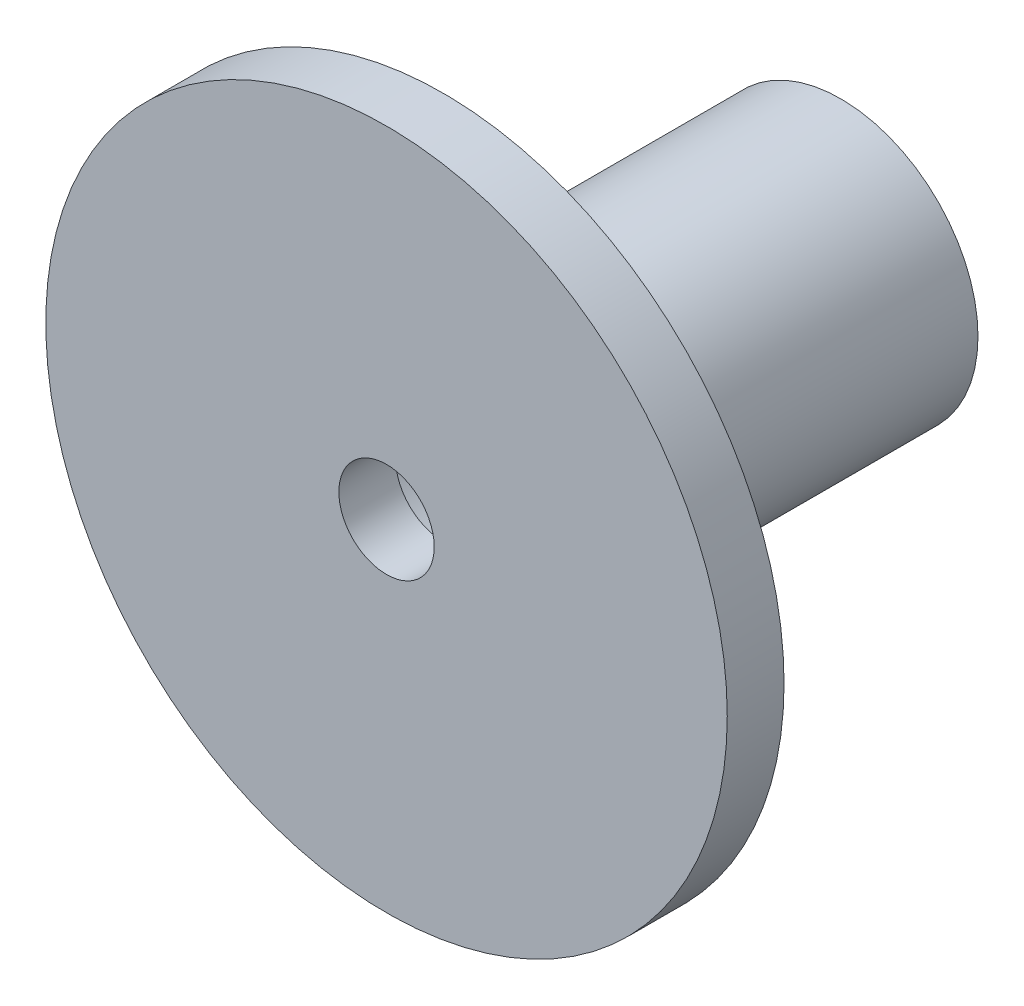
from build123d import *

# Parameters (mm, degrees)
SKETCH1_R           = 24.15
SKETCH1_R_2         = 20.3
BOSS_EXTRUDE1_DEPTH = 70
CUT_EXTRUDE1_START  = -3.2
SKETCH2_R           = 21.65
SKETCH2_R_2         = 20.3
CUT_EXTRUDE1_DEPTH  = 3.2
SKETCH3_R           = 60
SKETCH3_R_2         = 8.4
BOSS_EXTRUDE2_DEPTH = 10


with BuildPart() as part:
    # Sketch1 → Boss-Extrude1 (new body)
    with BuildSketch(Plane.XY):
        Circle(SKETCH1_R)
        Circle(SKETCH1_R_2, mode=Mode.SUBTRACT)
    extrude(amount=BOSS_EXTRUDE1_DEPTH)

    # Sketch2 → Cut-Extrude1 (cut)
    with BuildSketch(Plane.XY.offset(70).offset(CUT_EXTRUDE1_START)):
        Circle(SKETCH2_R)
        Circle(SKETCH2_R_2, mode=Mode.SUBTRACT)
    extrude(amount=CUT_EXTRUDE1_DEPTH, mode=Mode.SUBTRACT)

    # Sketch3 → Boss-Extrude2 (add)
    with BuildSketch(Plane.XY.offset(70)):
        Circle(SKETCH3_R)
        Circle(SKETCH3_R_2, mode=Mode.SUBTRACT)
    extrude(amount=BOSS_EXTRUDE2_DEPTH)


solid = part.part
